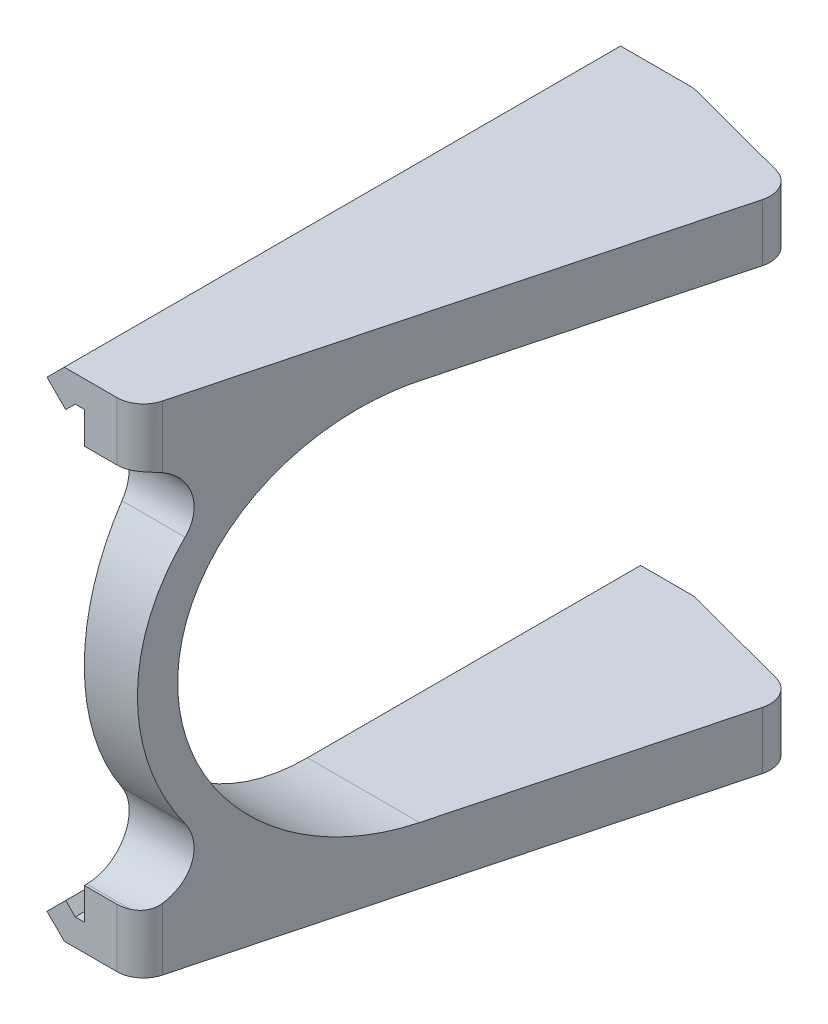
from build123d import *

# Parameters (mm, degrees)
BOSS_EXTRUDE1_DEPTH      = 91.992761
BOSS_EXTRUDE1_DEPTH_BACK = 12.782239
BOSS_EXTRUDE2_DEPTH      = 93.6375
CUT_EXTRUDE1_DEPTH       = 144.067335103
FILLET1_R                = 5


with BuildPart() as part:
    # Sketch1 → Boss-Extrude1 (new, two sides: drawn at the far end of the back side and taken through both)
    with BuildSketch(Plane.XY.offset(-BOSS_EXTRUDE1_DEPTH_BACK)):
        Polygon((-68.287510941, 96.719618957), (-66.487510941, 98.519618957), (-64.787510941, 98.519618957), (-64.787510941, 14.882118957), (-66.487510941, 14.882118957), (-68.287510941, 16.682118957), (-71.823044847, 13.146585051), (-68.558578753, 9.882118957), (-54.787510941, 9.882118957), (-54.787510941, 103.519618957), (-68.558578753, 103.519618957), (-71.823044847, 100.255152863), align=None)
    extrude(amount=BOSS_EXTRUDE1_DEPTH + BOSS_EXTRUDE1_DEPTH_BACK)

    # Sketch2 → Boss-Extrude2 (add)
    with BuildSketch(Plane(origin=(0, 9.882118957, 0), x_dir=(1, 0, 0), z_dir=(0, 1, 0))):
        Polygon((-54.787510941, 12.782239353), (-54.787510941, -91.992760647), (-28.880926753, 5.928233091), align=None)
    extrude(amount=BOSS_EXTRUDE2_DEPTH)

    # Sketch3 → Cut-Extrude1 (cut, through all)
    with BuildSketch(Plane.ZY.offset(64.787510941)):
        with BuildLine():
            Line((49.974010647, 92.719618957), (-12.782239353, 92.719618957))
            Line((-12.782239353, 92.719618957), (-12.782239353, 20.682118957))
            Line((-12.782239353, 20.682118957), (49.974010647, 20.682118957))
            ThreePointArc((49.974010647, 20.682118957), (85.992760647, 56.700868957), (49.974010647, 92.719618957))
        make_face()
        with BuildLine():
            Line((91.543139818, 20.882118957), (97.180187327, 20.882118957))
            Line((97.180187327, 20.882118957), (97.180187327, 92.519618957))
            Line((97.180187327, 92.519618957), (91.543139818, 92.519618957))
            ThreePointArc((91.543139818, 92.519618957), (84.486417774, 88.288262479), (84.894572363, 80.070287456))
            ThreePointArc((84.894572363, 80.070287456), (91.992760647, 56.700868957), (84.894572363, 33.331450457))
            ThreePointArc((84.894572363, 33.331450457), (84.486417774, 25.113475435), (91.543139818, 20.882118957))
        make_face()
    extrude(amount=-CUT_EXTRUDE1_DEPTH, mode=Mode.SUBTRACT)

    # Fillet1
    fillet1_edges = [part.edges().sort_by_distance(p)[0] for p in [
        (-54.787510941, 15.282118957, -12.782239),
        (-54.787510941, 98.119618957, -12.782239),
        (-28.880926753, 15.282118957, -5.928233091),
        (-28.880926753, 98.119618957, -5.928233091),
        (-54.787510941, 15.382118957, 91.992761),
        (-54.787510941, 98.019618957, 91.992761),
    ]]
    fillet(fillet1_edges, radius=FILLET1_R)


solid = part.part
